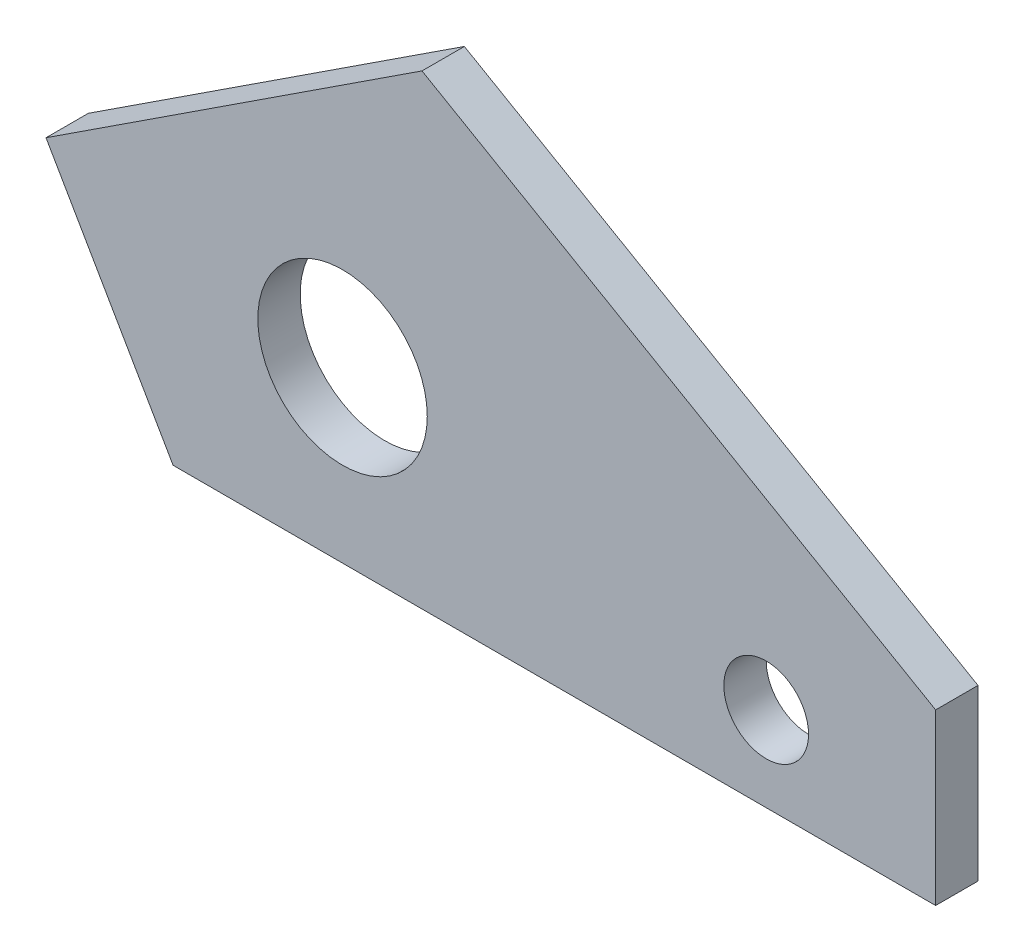
from build123d import *

# Parameters (mm, degrees)
BOSS_EXTRUDE1_DEPTH = 6.35
SKETCH2_R           = 12.7
SKETCH2_R_2         = 6.35
CUT_EXTRUDE1_DEPTH  = 153.900903887


with BuildPart() as part:
    # Sketch1 → Boss-Extrude1 (new body)
    with BuildSketch(Plane.XY):
        Polygon((-79.504817321, 69.85), (-2.515158924, 25.4), (-2.515158924, 0), (-116.815158924, 0), (-135.865158924, 32.995567884), align=None)
    extrude(amount=BOSS_EXTRUDE1_DEPTH)

    # Sketch2 → Cut-Extrude1 (cut, through all)
    with BuildSketch(Plane.XY.offset(6.35)):
        with Locations((-91.415158924, 25.4)):
            Circle(SKETCH2_R)
        with Locations((-27.915158924, 12.7)):
            Circle(SKETCH2_R_2)
    extrude(amount=-CUT_EXTRUDE1_DEPTH, mode=Mode.SUBTRACT)


solid = part.part
